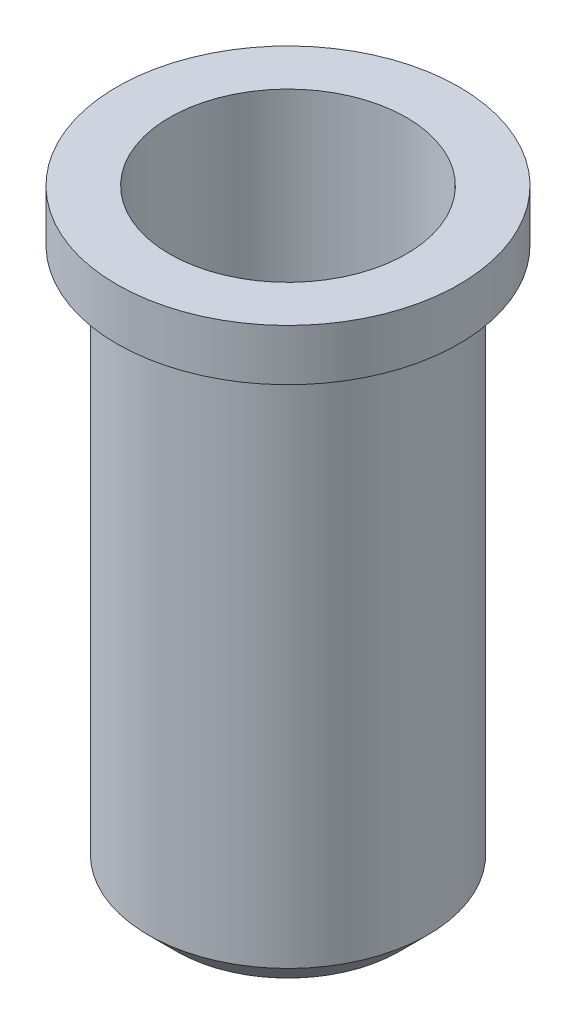
from build123d import *


with BuildPart() as part:
    # Sketch1 → Revolve1 (revolve)
    with BuildSketch(Plane.XY, mode=Mode.PRIVATE) as revolve1_sk:
        Polygon((1.0541, 5.4102), (1.0541, 0.8382), (0, 0.254), (0, 0), (0.9906, 0), (1.2446, 0.254), (1.2446, 4.953), (1.524, 4.953), (1.524, 5.4102), align=None)
    revolve(revolve1_sk.sketch.rotate(Axis((0, 0, 0), (0, 1, 0)), 90), axis=Axis((0, 0, 0), (0, 1, 0)))


solid = part.part
